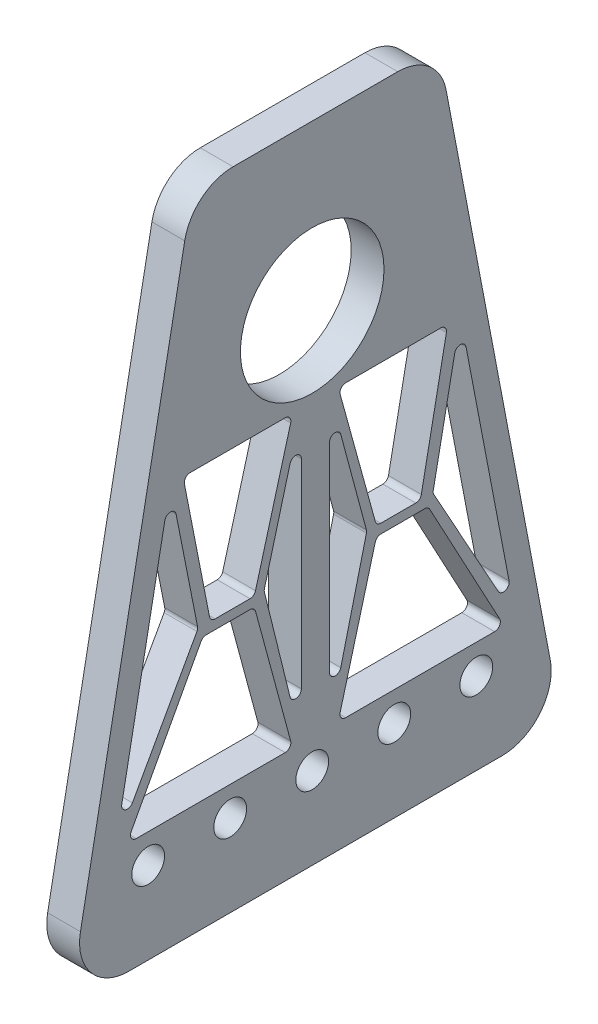
from build123d import *

# Parameters (mm, degrees)
SKETCH1_R           = 11.1125
SKETCH1_R_2         = 2.54
BOSS_EXTRUDE2_DEPTH = 5.08
FILLET1_R           = 7.62
CUT_EXTRUDE1_DEPTH  = 125.706848436
FILLET2_R           = 0.889


with BuildPart() as part:
    # Sketch1 → Boss-Extrude2 (new body)
    with BuildSketch(Plane(origin=(0, 0, 0), x_dir=(0, 0, -1), z_dir=(1, 0, 0))):
        Polygon((0, 0), (76.2, 0), (57.15, 99.798083649), (19.05, 99.798083649), align=None)
        with Locations((37.606341954, 74.398083649)):
            Circle(SKETCH1_R, mode=Mode.SUBTRACT)
        with Locations((37.606341954, 12.7)):
            Circle(SKETCH1_R_2, mode=Mode.SUBTRACT)
        with Locations((50.306341954, 12.7)):
            Circle(SKETCH1_R_2, mode=Mode.SUBTRACT)
        with Locations((63.006341954, 12.7)):
            Circle(SKETCH1_R_2, mode=Mode.SUBTRACT)
        with Locations((24.906341954, 12.7)):
            Circle(SKETCH1_R_2, mode=Mode.SUBTRACT)
        with Locations((12.206341954, 12.7)):
            Circle(SKETCH1_R_2, mode=Mode.SUBTRACT)
    extrude(amount=BOSS_EXTRUDE2_DEPTH)

    # Fillet1
    fillet1_edges = [part.edges().sort_by_distance(p)[0] for p in [
        (2.54, 99.798083649, -19.05),
        (2.54, 99.798083649, -57.15),
        (2.54, 0, -76.2),
        (2.54, 0, 0),
    ]]
    fillet(fillet1_edges, radius=FILLET1_R)

    # Sketch2 → Cut-Extrude1 (cut, through all)
    with BuildSketch(Plane(origin=(5.08, 0, 0), x_dir=(0, 0, -1), z_dir=(1, 0, 0))):
        Polygon((15.642904874, 62.107158672), (7.073205763, 17.452721053), (19.916541068, 40.570724603), align=None)
        Polygon((17.611424893, 62.107158672), (21.844949021, 40.570724603), (28.647489973, 40.570724603), (34.574296097, 62.107158672), align=None)
        Polygon((35.923336714, 62.107158672), (30.147133884, 40.570724603), (35.923336714, 17.219658997), align=None)
        Polygon((20.649761965, 39.113872964), (28.654674446, 39.113872964), (34.574296097, 17.219658997), (8.867656367, 17.219658997), align=None)
        Polygon((46.052866116, 40.570724603), (40.276663286, 17.219658997), (40.276663286, 62.107158672), align=None)
        Polygon((41.625703903, 17.219658997), (67.332343633, 17.219658997), (55.550238035, 39.113872964), (47.545325554, 39.113872964), align=None)
        Polygon((69.126794237, 17.452721053), (56.283458932, 40.570724603), (60.557095126, 62.107158672), align=None)
        Polygon((47.552510027, 40.570724603), (41.625703903, 62.107158672), (58.588575107, 62.107158672), (54.355050979, 40.570724603), align=None)
    extrude(amount=-CUT_EXTRUDE1_DEPTH, mode=Mode.SUBTRACT)

    # Fillet2
    fillet2_edges = [part.edges().sort_by_distance(p)[0] for p in [
        (2.54, 62.107158672, -17.611424893),
        (2.54, 62.107158672, -34.574296097),
        (2.54, 40.570724603, -28.647489973),
        (2.54, 40.570724603, -21.844949021),
        (2.54, 62.107158672, -35.923336714),
        (2.54, 17.219658997, -35.923336714),
        (2.54, 40.570724603, -30.147133884),
        (2.54, 40.570724603, -54.355050979),
        (2.54, 40.570724603, -47.552510027),
        (2.54, 62.107158672, -41.625703903),
        (2.54, 62.107158672, -58.588575107),
        (2.54, 17.219658997, -41.625703903),
        (2.54, 39.113872964, -47.545325554),
        (2.54, 39.113872964, -55.550238035),
        (2.54, 17.219658997, -67.332343633),
        (2.54, 62.107158672, -60.557095126),
        (2.54, 17.452721053, -69.126794237),
        (2.54, 40.570724603, -56.283458932),
        (2.54, 62.107158672, -15.642904874),
        (2.54, 40.570724603, -19.916541068),
        (2.54, 17.452721053, -7.073205763),
        (2.54, 62.107158672, -40.276663286),
        (2.54, 40.570724603, -46.052866116),
        (2.54, 17.219658997, -40.276663286),
        (2.54, 17.219658997, -34.574296097),
        (2.54, 17.219658997, -8.867656367),
        (2.54, 39.113872964, -20.649761965),
        (2.54, 39.113872964, -28.654674446),
    ]]
    fillet(fillet2_edges, radius=FILLET2_R)


solid = part.part
